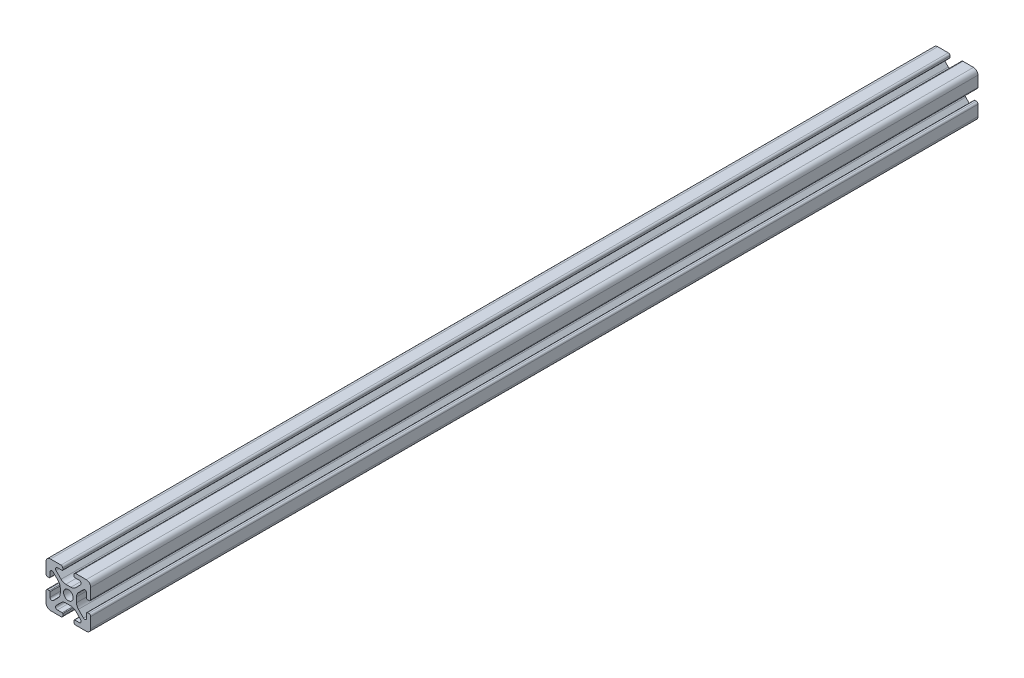
from build123d import *

# Parameters (mm, degrees)
SKETCH1_R           = 2.1463
BOSS_EXTRUDE1_DEPTH = 198.1911


with BuildPart() as part:
    # Sketch1 → Boss-Extrude1 (new, symmetric)
    with BuildSketch(Plane.XY):
        with BuildLine():
            Line((-9.9949, 7.9883), (-9.9949, 3.2893))
            ThreePointArc((-9.9949, 3.2893), (-9.76427588, 2.73252412), (-9.2075, 2.5019))
            Line((-9.2075, 2.5019), (-8.4963, 2.5019))
            ThreePointArc((-8.4963, 2.5019), (-8.280773853, 2.591173853), (-8.1915, 2.8067))
            Line((-8.1915, 2.8067), (-8.1915, 4.9149))
            ThreePointArc((-8.1915, 4.9149), (-7.674065253, 5.689295824), (-6.760603096, 5.507596904))
            Line((-6.760603096, 5.507596904), (-4.505765747, 3.252759555))
            ThreePointArc((-4.505765747, 3.252759555), (-3.856054457, 2.280397894), (-3.627906192, 1.133419111))
            Line((-3.627906192, 1.133419111), (-3.627906192, -1.133419111))
            ThreePointArc((-3.627906192, -1.133419111), (-3.856054457, -2.280397894), (-4.505765747, -3.252759555))
            Line((-4.505765747, -3.252759555), (-6.760603096, -5.507596904))
            ThreePointArc((-6.760603096, -5.507596904), (-7.674065253, -5.689295824), (-8.1915, -4.9149))
            Line((-8.1915, -4.9149), (-8.1915, -2.8067))
            ThreePointArc((-8.1915, -2.8067), (-8.280773853, -2.591173853), (-8.4963, -2.5019))
            Line((-8.4963, -2.5019), (-9.2075, -2.5019))
            ThreePointArc((-9.2075, -2.5019), (-9.76427588, -2.73252412), (-9.9949, -3.2893))
            Line((-9.9949, -3.2893), (-9.9949, -7.9883))
            ThreePointArc((-9.9949, -7.9883), (-9.407180467, -9.407180467), (-7.9883, -9.9949))
            Line((-7.9883, -9.9949), (-3.2893, -9.9949))
            ThreePointArc((-3.2893, -9.9949), (-2.73252412, -9.76427588), (-2.5019, -9.2075))
            Line((-2.5019, -9.2075), (-2.5019, -8.4963))
            ThreePointArc((-2.5019, -8.4963), (-2.591173853, -8.280773853), (-2.8067, -8.1915))
            Line((-2.8067, -8.1915), (-4.9149, -8.1915))
            ThreePointArc((-4.9149, -8.1915), (-5.689295824, -7.674065253), (-5.507596904, -6.760603096))
            Line((-5.507596904, -6.760603096), (-3.252759555, -4.505765747))
            ThreePointArc((-3.252759555, -4.505765747), (-2.280397894, -3.856054457), (-1.133419111, -3.627906192))
            Line((-1.133419111, -3.627906192), (1.133419111, -3.627906192))
            ThreePointArc((1.133419111, -3.627906192), (2.280397894, -3.856054457), (3.252759555, -4.505765747))
            Line((3.252759555, -4.505765747), (5.507596904, -6.760603096))
            ThreePointArc((5.507596904, -6.760603096), (5.689295824, -7.674065253), (4.9149, -8.1915))
            Line((4.9149, -8.1915), (2.8067, -8.1915))
            ThreePointArc((2.8067, -8.1915), (2.591173853, -8.280773853), (2.5019, -8.4963))
            Line((2.5019, -8.4963), (2.5019, -9.2075))
            ThreePointArc((2.5019, -9.2075), (2.73252412, -9.76427588), (3.2893, -9.9949))
            Line((3.2893, -9.9949), (7.9883, -9.9949))
            ThreePointArc((7.9883, -9.9949), (9.407180467, -9.407180467), (9.9949, -7.9883))
            Line((9.9949, -7.9883), (9.9949, -3.2893))
            ThreePointArc((9.9949, -3.2893), (9.76427588, -2.73252412), (9.2075, -2.5019))
            Line((9.2075, -2.5019), (8.4963, -2.5019))
            ThreePointArc((8.4963, -2.5019), (8.280773853, -2.591173853), (8.1915, -2.8067))
            Line((8.1915, -2.8067), (8.1915, -4.9149))
            ThreePointArc((8.1915, -4.9149), (7.674065253, -5.689295824), (6.760603096, -5.507596904))
            Line((6.760603096, -5.507596904), (4.505765747, -3.252759555))
            ThreePointArc((4.505765747, -3.252759555), (3.856054457, -2.280397894), (3.627906192, -1.133419111))
            Line((3.627906192, -1.133419111), (3.627906192, 1.133419111))
            ThreePointArc((3.627906192, 1.133419111), (3.856054457, 2.280397894), (4.505765747, 3.252759555))
            Line((4.505765747, 3.252759555), (6.760603096, 5.507596904))
            ThreePointArc((6.760603096, 5.507596904), (7.674065253, 5.689295824), (8.1915, 4.9149))
            Line((8.1915, 4.9149), (8.1915, 2.8067))
            ThreePointArc((8.1915, 2.8067), (8.280773853, 2.591173853), (8.4963, 2.5019))
            Line((8.4963, 2.5019), (9.2075, 2.5019))
            ThreePointArc((9.2075, 2.5019), (9.76427588, 2.73252412), (9.9949, 3.2893))
            Line((9.9949, 3.2893), (9.9949, 7.9883))
            ThreePointArc((9.9949, 7.9883), (9.407180467, 9.407180467), (7.9883, 9.9949))
            Line((7.9883, 9.9949), (3.2893, 9.9949))
            ThreePointArc((3.2893, 9.9949), (2.73252412, 9.76427588), (2.5019, 9.2075))
            Line((2.5019, 9.2075), (2.5019, 8.4963))
            ThreePointArc((2.5019, 8.4963), (2.591173853, 8.280773853), (2.8067, 8.1915))
            Line((2.8067, 8.1915), (4.9149, 8.1915))
            ThreePointArc((4.9149, 8.1915), (5.689295824, 7.674065253), (5.507596904, 6.760603096))
            Line((5.507596904, 6.760603096), (3.252759555, 4.505765747))
            ThreePointArc((3.252759555, 4.505765747), (2.280397894, 3.856054457), (1.133419111, 3.627906192))
            Line((1.133419111, 3.627906192), (-1.133419111, 3.627906192))
            ThreePointArc((-1.133419111, 3.627906192), (-2.280397894, 3.856054457), (-3.252759555, 4.505765747))
            Line((-3.252759555, 4.505765747), (-5.507596904, 6.760603096))
            ThreePointArc((-5.507596904, 6.760603096), (-5.689295824, 7.674065253), (-4.9149, 8.1915))
            Line((-4.9149, 8.1915), (-2.8067, 8.1915))
            ThreePointArc((-2.8067, 8.1915), (-2.591173853, 8.280773853), (-2.5019, 8.4963))
            Line((-2.5019, 8.4963), (-2.5019, 9.2075))
            ThreePointArc((-2.5019, 9.2075), (-2.73252412, 9.76427588), (-3.2893, 9.9949))
            Line((-3.2893, 9.9949), (-7.9883, 9.9949))
            ThreePointArc((-7.9883, 9.9949), (-9.407180467, 9.407180467), (-9.9949, 7.9883))
        make_face()
        Circle(SKETCH1_R, mode=Mode.SUBTRACT)
    extrude(amount=BOSS_EXTRUDE1_DEPTH, both=True)


solid = part.part
